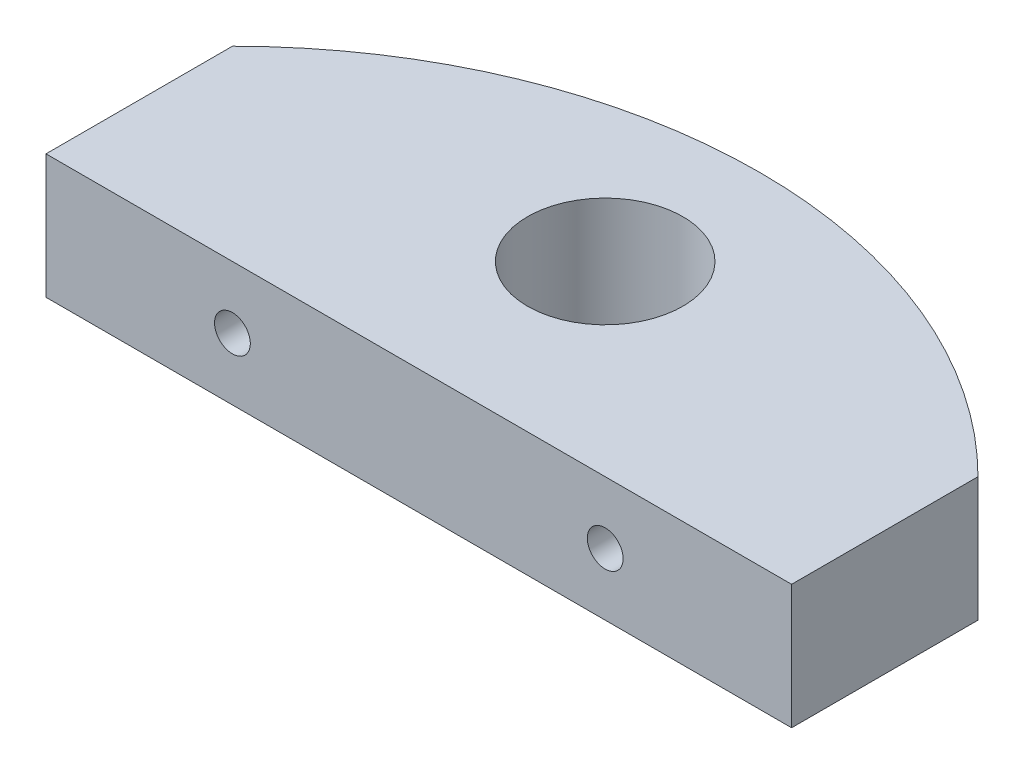
from build123d import *

# Parameters (mm, degrees)
BOSS_EXTRUDE1_DEPTH                               = 12.7
F_5_8_0_6250_DOWEL_HOLE2_D                        = 15.875
CSK_FOR_6_FLAT_HEAD_MACHINE_SCREW_100_D           = 3.6576
CSK_FOR_6_FLAT_HEAD_MACHINE_SCREW_100_CSINK_D     = 7.0866
CSK_FOR_6_FLAT_HEAD_MACHINE_SCREW_100_CSINK_ANGLE = 100


with BuildPart() as part:
    # Sketch2 → Boss-Extrude1 (new body)
    with BuildSketch(Plane(origin=(0, 0, 0), x_dir=(1, 0, 0), z_dir=(0, 1, 0))):
        with BuildLine():
            Line((0, 0), (-76.2, 0))
            Line((-76.2, 0), (-76.2, 19.05))
            ThreePointArc((-76.2, 19.05), (-38.1, 34.831536726), (0, 19.05))
            Line((0, 19.05), (0, 0))
        make_face()
    extrude(amount=BOSS_EXTRUDE1_DEPTH)

    # 5/8 (0.6250) Dowel Hole2 (through all)
    with Locations(Plane(origin=(0, 12.7, 0), x_dir=(1, 0, 0), z_dir=(0, 1, 0))):
        with Locations((-38.1, 19.05)):
            Hole(F_5_8_0_6250_DOWEL_HOLE2_D / 2)

    # CSK for #6 Flat Head Machine Screw (100)3 (through all)
    with Locations(Plane(origin=(0, 0, -32.5882), x_dir=(1, 0, 0), z_dir=(0, 0, -1))):
        with Locations((-19.05, -6.35), (-57.15, -6.35)):
            CounterSinkHole(CSK_FOR_6_FLAT_HEAD_MACHINE_SCREW_100_D / 2, CSK_FOR_6_FLAT_HEAD_MACHINE_SCREW_100_CSINK_D / 2, counter_sink_angle=CSK_FOR_6_FLAT_HEAD_MACHINE_SCREW_100_CSINK_ANGLE)


solid = part.part
